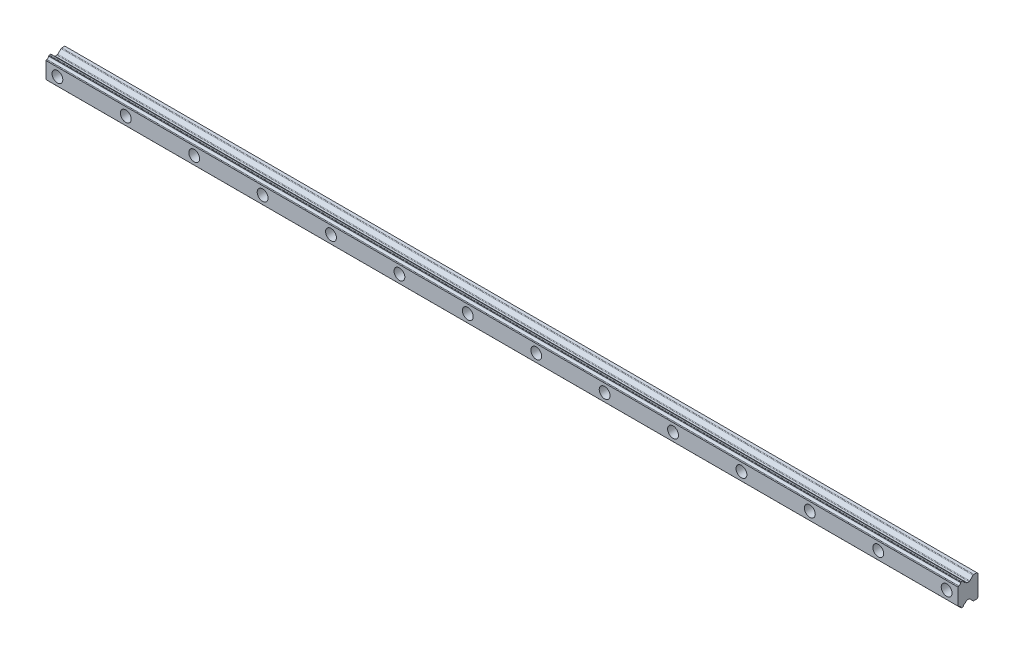
from build123d import *

# Parameters (mm, degrees)
HGR_HGR20_1_DEPTH = 800
HOLE1_D           = 6
HOLE1_CBORE_D     = 9.5
HOLE1_CBORE_DEPTH = 8.5
CRVPATTERN1_COUNT = 14
CRVPATTERN1_PITCH = 60


with BuildPart() as part:
    # Sketch14 → Hgr HGR20(1) (new body)
    with BuildSketch(Plane(origin=(0, 0, 0), x_dir=(0, -1, 0), z_dir=(-1, 0, 0))):
        with BuildLine():
            Line((-9, 0), (9, 0))
            Line((9, 0), (10, 1))
            Line((10, 1), (10, 3.656507036))
            ThreePointArc((10, 3.656507036), (9.92387953, 4.039190479), (9.707106773, 4.363613837))
            Line((9.707106773, 4.363613837), (6.892893227, 7.177827383))
            ThreePointArc((6.892893227, 7.177827383), (6.67612047, 7.502250741), (6.6, 7.884934184))
            Line((6.6, 7.884934184), (6.6, 9.445065806))
            ThreePointArc((6.6, 9.445065806), (6.67612047, 9.827749249), (6.892893227, 10.152172607))
            Line((6.892893227, 10.152172607), (7.63016236, 10.88944174))
            ThreePointArc((7.63016236, 10.88944174), (7.773916168, 11.035785916), (7.84680643, 11.2275378))
            ThreePointArc((7.84680643, 11.2275378), (8.396388337, 12.262927707), (9.431778248, 12.812509604))
            ThreePointArc((9.431778248, 12.812509604), (9.57149389, 12.861817745), (9.690625667, 12.949905047))
            Line((9.690625667, 12.949905047), (9.85355341, 13.11283279))
            ThreePointArc((9.85355341, 13.11283279), (9.961939771, 13.275044443), (10, 13.466386134))
            Line((10, 13.466386134), (10, 14.523613846))
            ThreePointArc((10, 14.523613846), (9.961939771, 14.714955537), (9.85355341, 14.87716719))
            Line((9.85355341, 14.87716719), (9.678500884, 15.052219716))
            ThreePointArc((9.678500884, 15.052219716), (9.560417671, 15.13974885), (9.421985128, 15.189159636))
            ThreePointArc((9.421985128, 15.189159636), (8.395921997, 15.736919373), (7.84816225, 16.7629825))
            ThreePointArc((7.84816225, 16.7629825), (7.7751915, 16.95300083), (7.63253117, 17.09818942))
            Line((7.63253117, 17.09818942), (7.23072061, 17.49999998))
            Line((7.23072061, 17.49999998), (-7.23072061, 17.49999998))
            Line((-7.23072061, 17.49999998), (-7.63253117, 17.09818942))
            ThreePointArc((-7.63253117, 17.09818942), (-7.775191493, 16.953000826), (-7.84816225, 16.7629825))
            ThreePointArc((-7.84816225, 16.7629825), (-8.395921988, 15.736919382), (-9.421985103, 15.189159641))
            ThreePointArc((-9.421985103, 15.189159641), (-9.560417671, 15.139748844), (-9.678500907, 15.052219693))
            Line((-9.678500907, 15.052219693), (-9.85355341, 14.87716719))
            ThreePointArc((-9.85355341, 14.87716719), (-9.961939771, 14.714955537), (-10, 14.523613846))
            Line((-10, 14.523613846), (-10, 13.466386134))
            ThreePointArc((-10, 13.466386134), (-9.961939771, 13.275044443), (-9.85355341, 13.11283279))
            Line((-9.85355341, 13.11283279), (-9.690625709, 12.949905089))
            ThreePointArc((-9.690625709, 12.949905089), (-9.571493891, 12.861817755), (-9.431778202, 12.812509595))
            ThreePointArc((-9.431778202, 12.812509595), (-8.39638832, 12.26292769), (-7.84680643, 11.2275378))
            ThreePointArc((-7.84680643, 11.2275378), (-7.773916172, 11.035785914), (-7.63016236, 10.88944174))
            Line((-7.63016236, 10.88944174), (-6.892893227, 10.152172607))
            ThreePointArc((-6.892893227, 10.152172607), (-6.67612047, 9.827749249), (-6.6, 9.445065806))
            Line((-6.6, 9.445065806), (-6.6, 7.884934184))
            ThreePointArc((-6.6, 7.884934184), (-6.67612047, 7.502250741), (-6.892893227, 7.177827383))
            Line((-6.892893227, 7.177827383), (-9.707106773, 4.363613837))
            ThreePointArc((-9.707106773, 4.363613837), (-9.92387953, 4.039190479), (-10, 3.656507036))
            Line((-10, 3.656507036), (-10, 1))
            Line((-10, 1), (-9, 0))
        make_face()
    extrude(amount=HGR_HGR20_1_DEPTH)

    # Hole1 (through all)
    with Locations(Plane.XY.offset(17.49999998)):
        with Locations((-10, 0)):
            hole1 = CounterBoreHole(HOLE1_D / 2, HOLE1_CBORE_D / 2, HOLE1_CBORE_DEPTH)

    # CrvPattern1: Hole1 ×14
    with Locations(*[(-i * CRVPATTERN1_PITCH, 0, 0) for i in range(1, CRVPATTERN1_COUNT)]):
        add(hole1, mode=Mode.SUBTRACT)


solid = part.part
